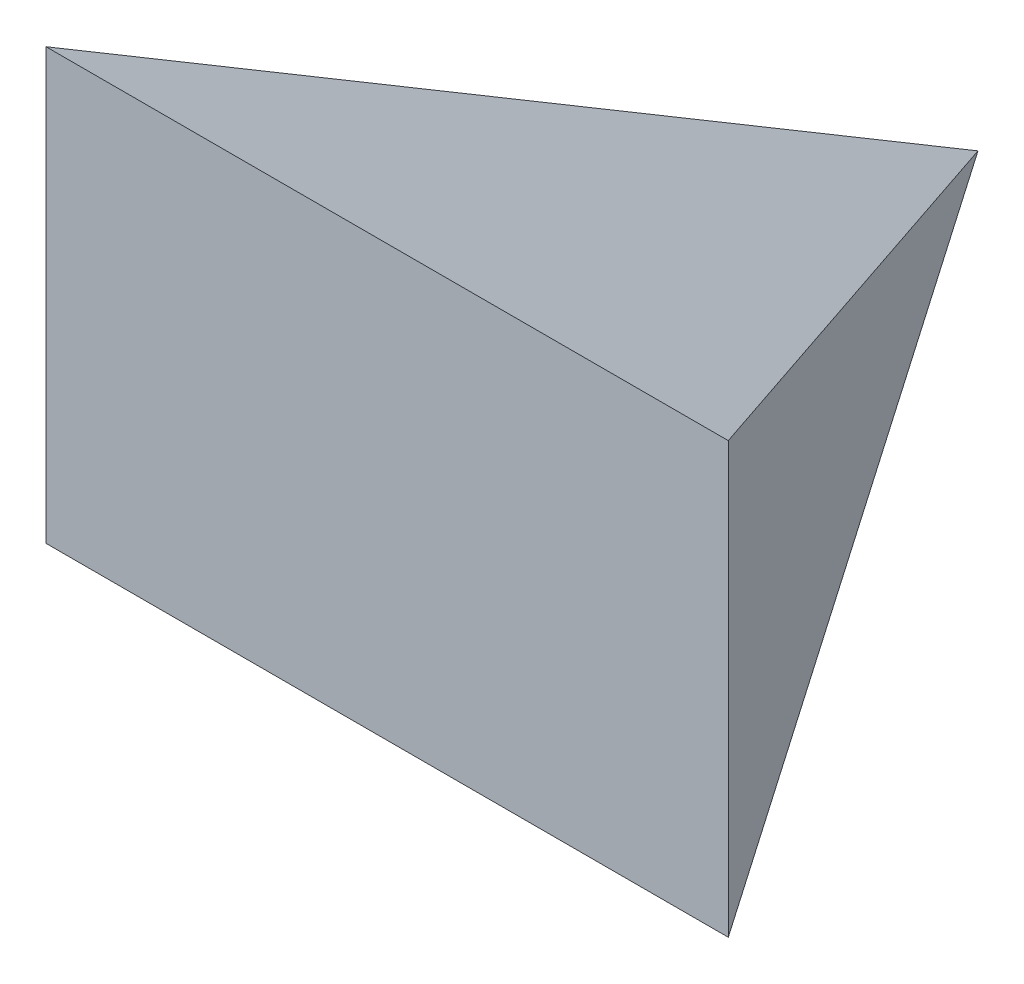
from build123d import *


with BuildPart() as part:
    # Sketch3 → Loft1 section 0
    with BuildSketch(Plane.XY.offset(660.4), mode=Mode.PRIVATE) as loft1_s0:
        with BuildLine():
            Line((381.282117773, -240.365942709), (-381.282117773, -240.365942709))
            Line((-381.282117773, -240.365942709), (-381.282117773, 240.365942709))
            Line((-381.282117773, 240.365942709), (381.282117773, 240.365942709))
            Line((381.282117773, 240.365942709), (381.282117773, -240.365942709))
        make_face()
    loft([Vertex(0, 0, 0), loft1_s0.sketch])


solid = part.part
